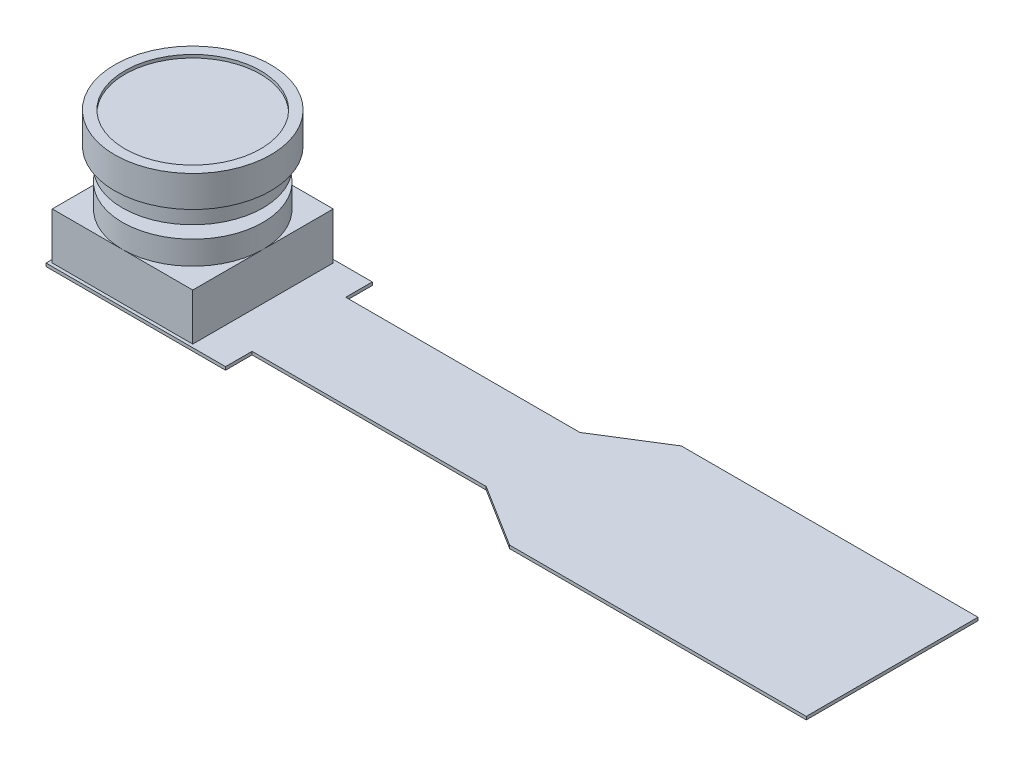
from build123d import *

# Parameters (mm, degrees)
SKETCH1_W           = 9
SKETCH1_H           = 9
BOSS_EXTRUDE1_DEPTH = 3
SKETCH2_R           = 4.5
BOSS_EXTRUDE2_DEPTH = 1.5
SKETCH3_R           = 3.25
BOSS_EXTRUDE3_DEPTH = 0.8
SKETCH4_R           = 4.5
BOSS_EXTRUDE4_DEPTH = 1.2
SKETCH6_R           = 5
BOSS_EXTRUDE5_DEPTH = 2
SKETCH7_R           = 4.344901587
CUT_EXTRUDE1_DEPTH  = 0.2
BOSS_EXTRUDE6_DEPTH = 0.2


with BuildPart() as part:
    # Sketch1 → Boss-Extrude1 (new body)
    with BuildSketch(Plane(origin=(0, 0, 0), x_dir=(1, 0, 0), z_dir=(0, 1, 0))):
        Rectangle(SKETCH1_W, SKETCH1_H)
    extrude(amount=BOSS_EXTRUDE1_DEPTH)

    # Sketch2 → Boss-Extrude2 (add)
    with BuildSketch(Plane(origin=(0, 3, 0), x_dir=(1, 0, 0), z_dir=(0, 1, 0))):
        with Locations(Location((0, 0, 0), (0, 0, 270))):
            Circle(SKETCH2_R)
    extrude(amount=BOSS_EXTRUDE2_DEPTH)

    # Sketch3 → Boss-Extrude3 (add)
    with BuildSketch(Plane(origin=(0, 4.5, 0), x_dir=(1, 0, 0), z_dir=(0, 1, 0))):
        with Locations(Location((0, 0, 0), (0, 0, 270))):
            Circle(SKETCH3_R)
    extrude(amount=BOSS_EXTRUDE3_DEPTH)

    # Sketch4 → Boss-Extrude4 (add)
    with BuildSketch(Plane(origin=(0, 5.3, 0), x_dir=(1, 0, 0), z_dir=(0, 1, 0))):
        with Locations(Location((0, 0, 0), (0, 0, 270))):
            Circle(SKETCH4_R)
    extrude(amount=BOSS_EXTRUDE4_DEPTH)

    # Sketch6 → Boss-Extrude5 (add)
    with BuildSketch(Plane(origin=(0, 6.5, 0), x_dir=(1, 0, 0), z_dir=(0, 1, 0))):
        with Locations(Location((0, 0, 0), (0, 0, 270))):
            Circle(SKETCH6_R)
    extrude(amount=BOSS_EXTRUDE5_DEPTH)

    # Sketch7 → Cut-Extrude1 (cut)
    with BuildSketch(Plane(origin=(0, 8.5, 0), x_dir=(1, 0, 0), z_dir=(0, 1, 0))):
        with Locations(Location((0, 0, 0), (0, 0, 270))):
            Circle(SKETCH7_R)
    extrude(amount=-CUT_EXTRUDE1_DEPTH, mode=Mode.SUBTRACT)

    # Sketch8 → Boss-Extrude6 (add)
    with BuildSketch(Plane.XZ):
        Polygon((6.8, 4.7), (6.8, 3), (21.8, 3), (25.8, 5.5), (44.8, 5.5), (44.8, -5.5), (25.8, -5.5), (21.8, -3), (6.8, -3), (6.8, -4.7), (-4.7, -4.7), (-4.7, 4.7), align=None)
    extrude(amount=BOSS_EXTRUDE6_DEPTH)


solid = part.part
